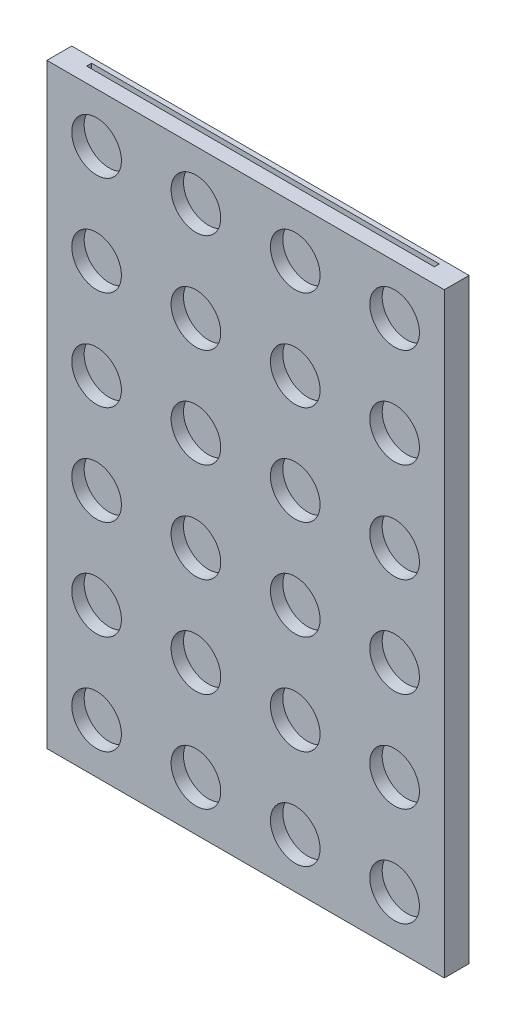
from build123d import *

# Parameters (mm, degrees)
SKETCH1_W           = 101.6
SKETCH1_H           = 152.4
BOSS_EXTRUDE1_DEPTH = 6.35
SKETCH3_R           = 6.35
CUT_EXTRUDE2_DEPTH  = 3.175
SKETCH4_W           = 88.9
SKETCH4_H           = 139.7
CUT_EXTRUDE3_DEPTH  = 2.54
CUT_EXTRUDE4_REACH  = 185.272
SKETCH5_W           = 88.9
SKETCH5_H           = 1.27


with BuildPart() as part:
    # Sketch1 → Boss-Extrude1 (new body)
    with BuildSketch(Plane.XY):
        with Locations((50.8, 76.2)):
            Rectangle(SKETCH1_W, SKETCH1_H)
    extrude(amount=BOSS_EXTRUDE1_DEPTH)

    # Sketch3 → Cut-Extrude2 (cut)
    with BuildSketch(Plane.XY.offset(6.35)):
        with Locations((12.7, 139.7)):
            Circle(SKETCH3_R)
        with Locations((38.1, 139.7)):
            Circle(SKETCH3_R)
        with Locations((63.5, 139.7)):
            Circle(SKETCH3_R)
        with Locations((88.9, 139.7)):
            Circle(SKETCH3_R)
        with Locations(Location((88.9, 114.3, 0), (0, 0, 180))):
            Circle(SKETCH3_R)
        with Locations(Location((63.5, 114.3, 0), (0, 0, 180))):
            Circle(SKETCH3_R)
        with Locations(Location((38.1, 114.3, 0), (0, 0, 180))):
            Circle(SKETCH3_R)
        with Locations(Location((12.7, 114.3, 0), (0, 0, 180))):
            Circle(SKETCH3_R)
        with Locations((88.9, 88.9)):
            Circle(SKETCH3_R)
        with Locations((63.5, 88.9)):
            Circle(SKETCH3_R)
        with Locations((38.1, 88.9)):
            Circle(SKETCH3_R)
        with Locations((12.7, 88.9)):
            Circle(SKETCH3_R)
        with Locations(Location((88.9, 63.5, 0), (0, 0, 180))):
            Circle(SKETCH3_R)
        with Locations(Location((63.5, 63.5, 0), (0, 0, 180))):
            Circle(SKETCH3_R)
        with Locations(Location((38.1, 63.5, 0), (0, 0, 180))):
            Circle(SKETCH3_R)
        with Locations(Location((12.7, 63.5, 0), (0, 0, 180))):
            Circle(SKETCH3_R)
        with Locations((88.9, 38.1)):
            Circle(SKETCH3_R)
        with Locations((63.5, 38.1)):
            Circle(SKETCH3_R)
        with Locations((38.1, 38.1)):
            Circle(SKETCH3_R)
        with Locations((12.7, 38.1)):
            Circle(SKETCH3_R)
        with Locations(Location((88.9, 12.7, 0), (0, 0, 180))):
            Circle(SKETCH3_R)
        with Locations(Location((63.5, 12.7, 0), (0, 0, 180))):
            Circle(SKETCH3_R)
        with Locations(Location((38.1, 12.7, 0), (0, 0, 180))):
            Circle(SKETCH3_R)
        with Locations(Location((12.7, 12.7, 0), (0, 0, 180))):
            Circle(SKETCH3_R)
    extrude(amount=-CUT_EXTRUDE2_DEPTH, mode=Mode.SUBTRACT)

    # Sketch4 → Cut-Extrude3 (cut)
    with BuildSketch(Plane(origin=(0, 0, 0), x_dir=(-1, 0, 0), z_dir=(0, 0, -1))):
        with Locations((-50.8, 76.2)):
            Rectangle(SKETCH4_W, SKETCH4_H)
    extrude(amount=-CUT_EXTRUDE3_DEPTH, mode=Mode.SUBTRACT)

    # Sketch5 → Cut-Extrude4 (cut, up to next)
    with BuildSketch(Plane(origin=(0, 152.4, 0), x_dir=(1, 0, 0), z_dir=(0, 1, 0)), mode=Mode.PRIVATE) as cut_extrude4_sk1:
        with Locations((50.8, -1.905)):
            Rectangle(SKETCH5_W, SKETCH5_H)
    cut_extrude4_tool1 = extrude(cut_extrude4_sk1.sketch, amount=-CUT_EXTRUDE4_REACH, mode=Mode.PRIVATE) & part.part
    add(cut_extrude4_tool1.solids().sort_by_distance((50.8, 152.4, 1.905))[0], mode=Mode.SUBTRACT)


solid = part.part
